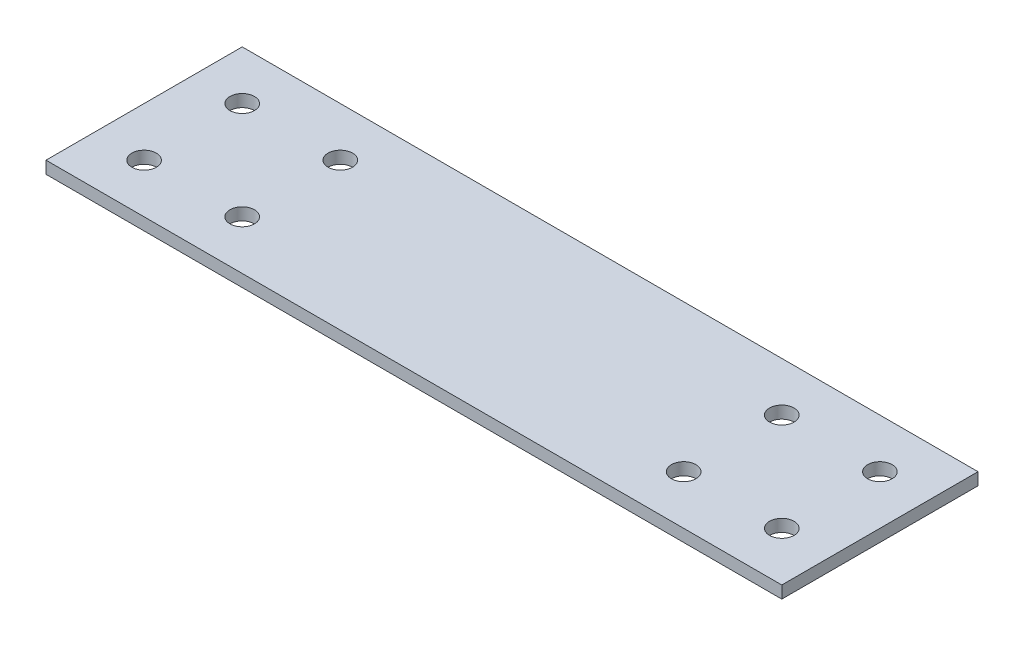
from build123d import *

# Parameters (mm, degrees)
SKETCH1_W           = 139.7
SKETCH1_H           = 50.8
BOSS_EXTRUDE1_DEPTH = 25.4
CUT_EXTRUDE1_REACH  = 146.244
SKETCH2_W           = 50.8
SKETCH2_H           = 22.225
SKETCH3_R           = 3.175
CUT_EXTRUDE2_DEPTH  = 75.392628163
SKETCH5_W           = 50.8
SKETCH5_H           = 3.175
BOSS_EXTRUDE2_DEPTH = 25.4
SKETCH7_W           = 50.8
SKETCH7_H           = 3.175
BOSS_EXTRUDE3_DEPTH = 25.4
CUT_EXTRUDE3_REACH  = 100.63
SKETCH8_R           = 3.175


with BuildPart() as part:
    # Sketch1 → Boss-Extrude1 (new body)
    with BuildSketch(Plane(origin=(0, 0, 0), x_dir=(1, 0, 0), z_dir=(0, 1, 0))):
        Rectangle(SKETCH1_W, SKETCH1_H)
    extrude(amount=BOSS_EXTRUDE1_DEPTH)

    # Sketch2 → Cut-Extrude1 (cut, up to next)
    with BuildSketch(Plane.ZY.offset(69.85), mode=Mode.PRIVATE) as cut_extrude1_sk1:
        with Locations((0, 11.1125)):
            Rectangle(SKETCH2_W, SKETCH2_H)
    cut_extrude1_tool1 = extrude(cut_extrude1_sk1.sketch, amount=-CUT_EXTRUDE1_REACH, mode=Mode.PRIVATE) & part.part
    add(cut_extrude1_tool1.solids().sort_by_distance((-69.85, 11.1125, 0))[0], mode=Mode.SUBTRACT)

    # Sketch3 → Cut-Extrude2 (cut, through all)
    with BuildSketch(Plane(origin=(0, 25.4, 0), x_dir=(1, 0, 0), z_dir=(0, 1, 0))):
        with Locations(Location((-57.15, 12.7, 0), (0, 0, 270))):
            Circle(SKETCH3_R)
        with Locations(Location((-57.15, -12.7, 0), (0, 0, 270))):
            Circle(SKETCH3_R)
        with Locations(Location((57.15, -12.7, 0), (0, 0, 270))):
            Circle(SKETCH3_R)
        with Locations(Location((57.15, 12.7, 0), (0, 0, 270))):
            Circle(SKETCH3_R)
    extrude(amount=-CUT_EXTRUDE2_DEPTH, mode=Mode.SUBTRACT)

    # Sketch5 → Boss-Extrude2 (add)
    with BuildSketch(Plane.ZY.offset(69.85)):
        with Locations((0, 23.8125)):
            Rectangle(SKETCH5_W, SKETCH5_H)
    extrude(amount=BOSS_EXTRUDE2_DEPTH)

    # Sketch7 → Boss-Extrude3 (add)
    with BuildSketch(Plane(origin=(69.85, 0, 0), x_dir=(0, 0, -1), z_dir=(1, 0, 0))):
        with Locations((0, 23.8125)):
            Rectangle(SKETCH7_W, SKETCH7_H)
    extrude(amount=BOSS_EXTRUDE3_DEPTH)

    # Sketch8 → Cut-Extrude3 (cut, up to next)
    with BuildSketch(Plane(origin=(0, 25.4, 0), x_dir=(1, 0, 0), z_dir=(0, 1, 0)), mode=Mode.PRIVATE) as cut_extrude3_sk1:
        with Locations(Location((-82.55, 12.7, 0), (0, 0, 270))):
            Circle(SKETCH8_R)
    cut_extrude3_tool1 = extrude(cut_extrude3_sk1.sketch, amount=-CUT_EXTRUDE3_REACH, mode=Mode.PRIVATE) & part.part
    # Sketch8 → Cut-Extrude3 (cut, up to next)
    with BuildSketch(Plane(origin=(0, 25.4, 0), x_dir=(1, 0, 0), z_dir=(0, 1, 0)), mode=Mode.PRIVATE) as cut_extrude3_sk2:
        with Locations(Location((-82.55, -12.7, 0), (0, 0, 270))):
            Circle(SKETCH8_R)
    cut_extrude3_tool2 = extrude(cut_extrude3_sk2.sketch, amount=-CUT_EXTRUDE3_REACH, mode=Mode.PRIVATE) & part.part
    # Sketch8 → Cut-Extrude3 (cut, up to next)
    with BuildSketch(Plane(origin=(0, 25.4, 0), x_dir=(1, 0, 0), z_dir=(0, 1, 0)), mode=Mode.PRIVATE) as cut_extrude3_sk3:
        with Locations(Location((82.55, -12.7, 0), (0, 0, 270))):
            Circle(SKETCH8_R)
    cut_extrude3_tool3 = extrude(cut_extrude3_sk3.sketch, amount=-CUT_EXTRUDE3_REACH, mode=Mode.PRIVATE) & part.part
    # Sketch8 → Cut-Extrude3 (cut, up to next)
    with BuildSketch(Plane(origin=(0, 25.4, 0), x_dir=(1, 0, 0), z_dir=(0, 1, 0)), mode=Mode.PRIVATE) as cut_extrude3_sk4:
        with Locations(Location((82.55, 12.7, 0), (0, 0, 270))):
            Circle(SKETCH8_R)
    cut_extrude3_tool4 = extrude(cut_extrude3_sk4.sketch, amount=-CUT_EXTRUDE3_REACH, mode=Mode.PRIVATE) & part.part
    add(cut_extrude3_tool1.solids().sort_by_distance((-82.55, 25.4, -12.7))[0], mode=Mode.SUBTRACT)
    add(cut_extrude3_tool2.solids().sort_by_distance((-82.55, 25.4, 12.7))[0], mode=Mode.SUBTRACT)
    add(cut_extrude3_tool3.solids().sort_by_distance((82.55, 25.4, 12.7))[0], mode=Mode.SUBTRACT)
    add(cut_extrude3_tool4.solids().sort_by_distance((82.55, 25.4, -12.7))[0], mode=Mode.SUBTRACT)


solid = part.part
